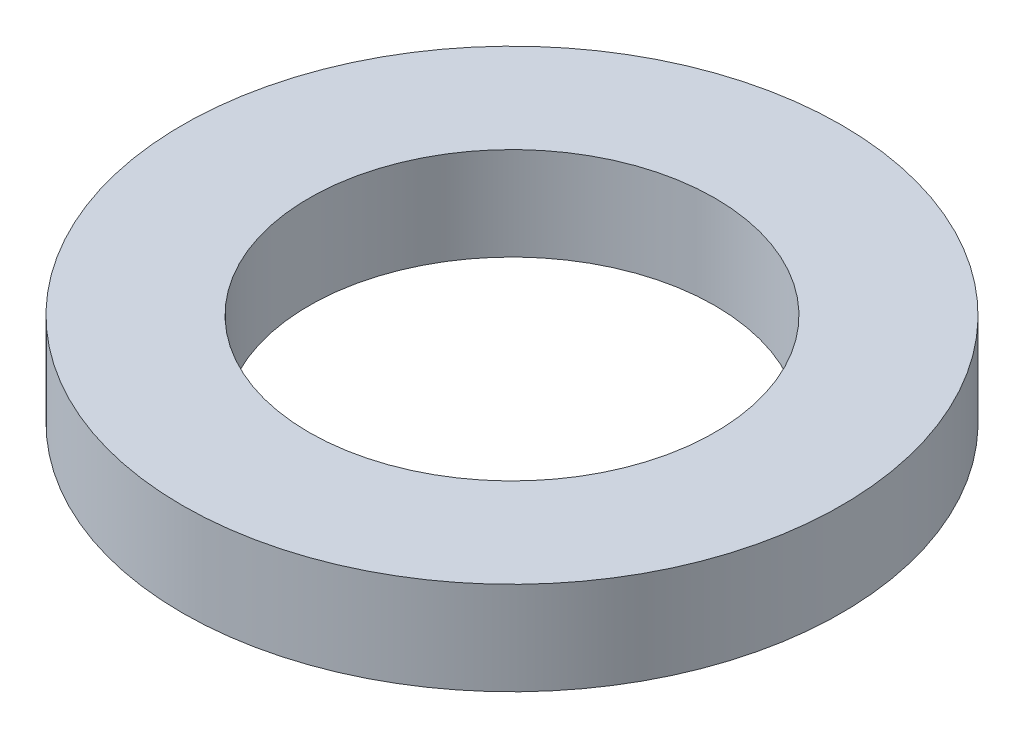
from build123d import *

# Parameters (mm, degrees)
SKETCH2_R           = 885
BOSS_EXTRUDE1_DEPTH = 250
SKETCH3_R           = 545
CUT_EXTRUDE1_DEPTH  = 250


with BuildPart() as part:
    # Sketch2 → Boss-Extrude1 (new body)
    with BuildSketch(Plane(origin=(0, 0, 0), x_dir=(1, 0, 0), z_dir=(0, 1, 0))):
        with Locations(Location((0, 0, 0), (0, 0, 270))):
            Circle(SKETCH2_R)
    extrude(amount=BOSS_EXTRUDE1_DEPTH)

    # Sketch3 → Cut-Extrude1 (cut)
    with BuildSketch(Plane(origin=(0, 250, 0), x_dir=(1, 0, 0), z_dir=(0, 1, 0))):
        with Locations(Location((0, 0, 0), (0, 0, 270))):
            Circle(SKETCH3_R)
    extrude(amount=-CUT_EXTRUDE1_DEPTH, mode=Mode.SUBTRACT)


solid = part.part
